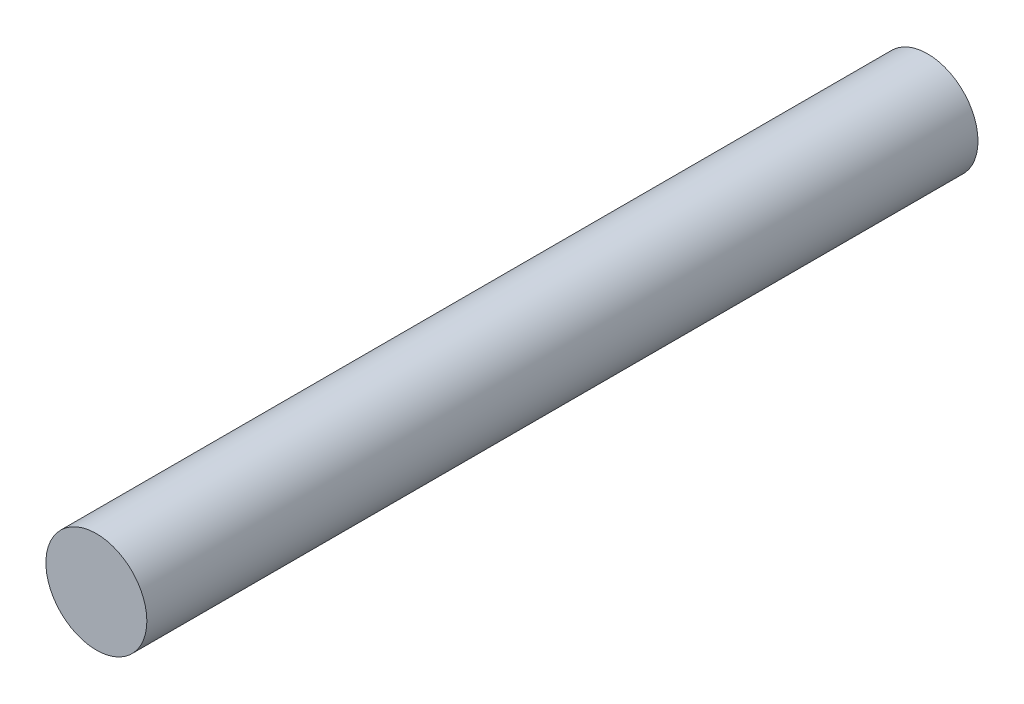
from build123d import *

# Parameters (mm, degrees)
BOSS_EXTRUDE1_DEPTH      = 33.2
BOSS_EXTRUDE1_DEPTH_BACK = 113.2
SKETCH1_R                = 8.89


with BuildPart() as part:
    # Sketch1 → Boss-Extrude1 (new, two sides: drawn at the far end of the back side and taken through both)
    with BuildSketch(Plane.XY.offset(-BOSS_EXTRUDE1_DEPTH_BACK)):
        Circle(SKETCH1_R)
    extrude(amount=BOSS_EXTRUDE1_DEPTH + BOSS_EXTRUDE1_DEPTH_BACK)


solid = part.part
